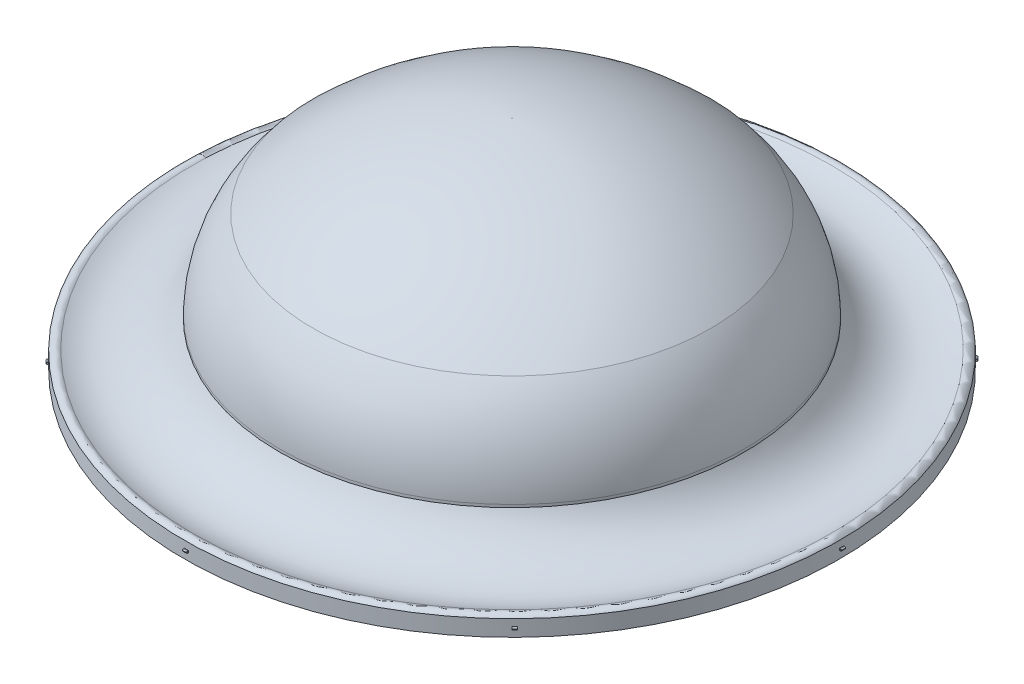
from build123d import *

# Parameters (mm, degrees)
CROQUIS3_R                 = 0.15
SALIENTE_EXTRUIR1_DEPTH    = 1
MATRIZC1_COUNT             = 8
CORTAR_EXTRUIR1_DEPTH      = 3.5
CORTAR_EXTRUIR1_DEPTH_BACK = 3.5


with BuildPart() as part:
    # Croquis1 → Revolución1 (revolve)
    with BuildSketch(Plane(origin=(0, 0, 0), x_dir=(0, 0, -1), z_dir=(1, 0, 0)), mode=Mode.PRIVATE) as revoluci_n1_sk:
        with BuildLine():
            Line((-53.706749403, -38.00205598), (-53.706749403, -39.862857986))
            ThreePointArc((-53.706749403, -39.862857986), (-66.128903849, -50.946483139), (-82.75, -50))
            Line((-82.75, -50), (-82.75, -45.913633918))
            ThreePointArc((-82.75, -45.913633918), (-81.749843887, -45.255213155), (-80.577052932, -45.496856538))
            ThreePointArc((-80.577052932, -45.496856538), (-68.28580191, -46.394407616), (-58.706749403, -38.640556786))
            Line((-58.706749403, -38.640556786), (-58.706749403, -37.948984749))
            ThreePointArc((-58.706749403, -37.948984749), (-56.396956017, -26.15017016), (-50.225083134, -15.832459353))
            ThreePointArc((-50.225083134, -15.832459353), (-27.121918445, -0.727624897), (-0.119641632, 4.998568383))
            Line((-0.119641632, 4.998568383), (0, 4.998568383))
            Line((0, 4.998568383), (0, 0))
            ThreePointArc((0, 0), (-25.090629498, -5.29813609), (-46.590589513, -19.275319426))
            ThreePointArc((-46.590589513, -19.275319426), (-51.761100349, -28.025963964), (-53.706749403, -38.00205598))
        make_face()
    revolve(revoluci_n1_sk.sketch.rotate(Axis((0, 0, 0), (0, 1, 0)), 180), axis=Axis((0, 0, 0), (0, 1, 0)))

    # Croquis3 → Saliente-Extruir1 (add)
    with BuildSketch(Plane.XY):
        with BuildLine():
            Line((-82.669777011, -47.619178632), (-82.96122925, -47.619178632))
            ThreePointArc((-82.96122925, -47.619178632), (-83.138005946, -47.692401937), (-83.21122925, -47.869178632))
            Line((-83.21122925, -47.869178632), (-83.21122925, -47.903618104))
            ThreePointArc((-83.21122925, -47.903618104), (-83.138005946, -48.080394799), (-82.96122925, -48.153618104))
            Line((-82.96122925, -48.153618104), (-82.669777011, -48.153618104))
            Line((-82.669777011, -48.153618104), (-82.669777011, -47.619178632))
        make_face()
        with Locations((-82.953032146, -47.876545308)):
            Circle(CROQUIS3_R, mode=Mode.SUBTRACT)
    saliente_extruir1 = extrude(amount=SALIENTE_EXTRUIR1_DEPTH)

    # MatrizC1: Saliente-Extruir1 ×8 about axis
    matrizc1_axis = Axis((0, 0, 0), (0, 1, 0))
    for i in range(1, MATRIZC1_COUNT):
        add(saliente_extruir1.rotate(matrizc1_axis, i * 360 / MATRIZC1_COUNT))

    # Croquis4 → Cortar-Extruir1 (cut, two sides: drawn at the far end of the back side and taken through both)
    with BuildSketch(Plane(origin=(0, 0, 0), x_dir=(0, 0, -1), z_dir=(1, 0, 0)).offset(-CORTAR_EXTRUIR1_DEPTH_BACK)):
        with BuildLine():
            Line((-13.463399876, -1.873922968), (14.527518877, -1.873922968))
            ThreePointArc((14.527518877, -1.873922968), (0.532059501, 0.452935275), (-13.463399876, -1.873922968))
        make_face()
    extrude(amount=CORTAR_EXTRUIR1_DEPTH + CORTAR_EXTRUIR1_DEPTH_BACK, mode=Mode.SUBTRACT)


solid = part.part
